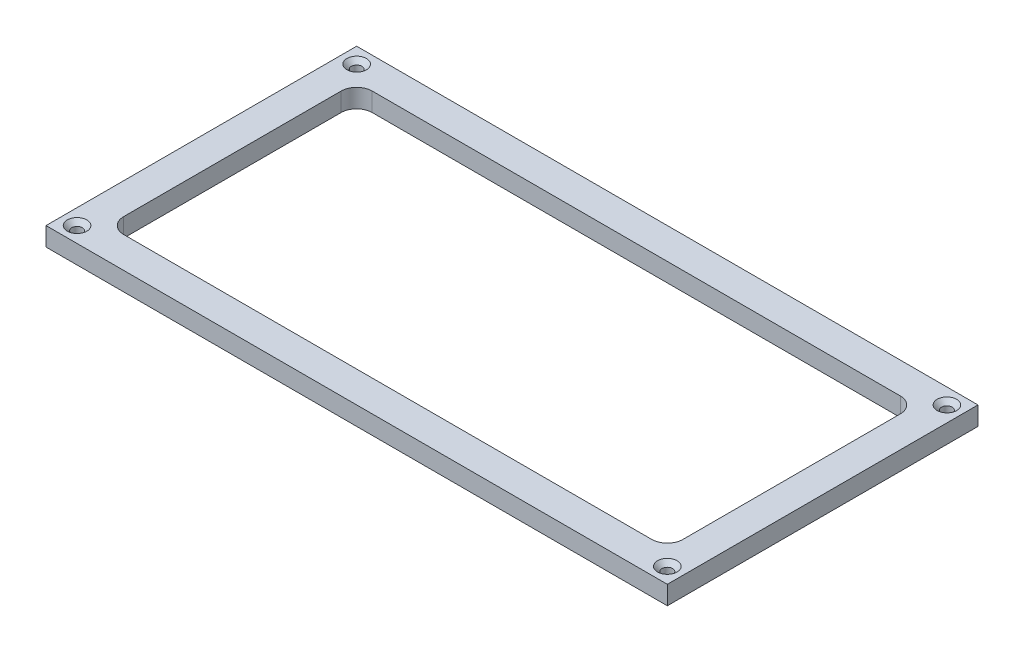
from build123d import *

# Parameters (mm, degrees)
SKETCH1_W                                           = 200
SKETCH1_H                                           = 100
BOSS_EXTRUDE1_DEPTH                                 = 6
SKETCH2_W                                           = 180
SKETCH2_H                                           = 80
CUT_EXTRUDE1_DEPTH                                  = 224.687281713
FILLET1_R                                           = 5
CSK_FOR_M3_COUNTERSUNK_FLAT_HEAD_SCREW1_D           = 3.4
CSK_FOR_M3_COUNTERSUNK_FLAT_HEAD_SCREW1_CSINK_D     = 6.3
CSK_FOR_M3_COUNTERSUNK_FLAT_HEAD_SCREW1_CSINK_ANGLE = 90


with BuildPart() as part:
    # Sketch1 → Boss-Extrude1 (new body)
    with BuildSketch(Plane(origin=(0, 0, 0), x_dir=(1, 0, 0), z_dir=(0, 1, 0))):
        with Locations((100, 50)):
            Rectangle(SKETCH1_W, SKETCH1_H)
    extrude(amount=BOSS_EXTRUDE1_DEPTH)

    # Sketch2 → Cut-Extrude1 (cut, through all)
    with BuildSketch(Plane(origin=(0, 6, 0), x_dir=(1, 0, 0), z_dir=(0, 1, 0))):
        with Locations((100, 50)):
            Rectangle(SKETCH2_W, SKETCH2_H)
    extrude(amount=-CUT_EXTRUDE1_DEPTH, mode=Mode.SUBTRACT)

    # Fillet1
    fillet1_edges = [part.edges().sort_by_distance(p)[0] for p in [
        (10, 3, -10),
        (10, 3, -90),
        (190, 3, -90),
        (190, 3, -10),
    ]]
    fillet(fillet1_edges, radius=FILLET1_R)

    # CSK for M3 Countersunk Flat Head Screw1 (through all)
    with Locations(Plane(origin=(0, 6, 0), x_dir=(1, 0, 0), z_dir=(0, 1, 0))):
        with Locations((5, 5), (5, 95), (195, 95), (195, 5)):
            CounterSinkHole(CSK_FOR_M3_COUNTERSUNK_FLAT_HEAD_SCREW1_D / 2, CSK_FOR_M3_COUNTERSUNK_FLAT_HEAD_SCREW1_CSINK_D / 2, counter_sink_angle=CSK_FOR_M3_COUNTERSUNK_FLAT_HEAD_SCREW1_CSINK_ANGLE)


solid = part.part
